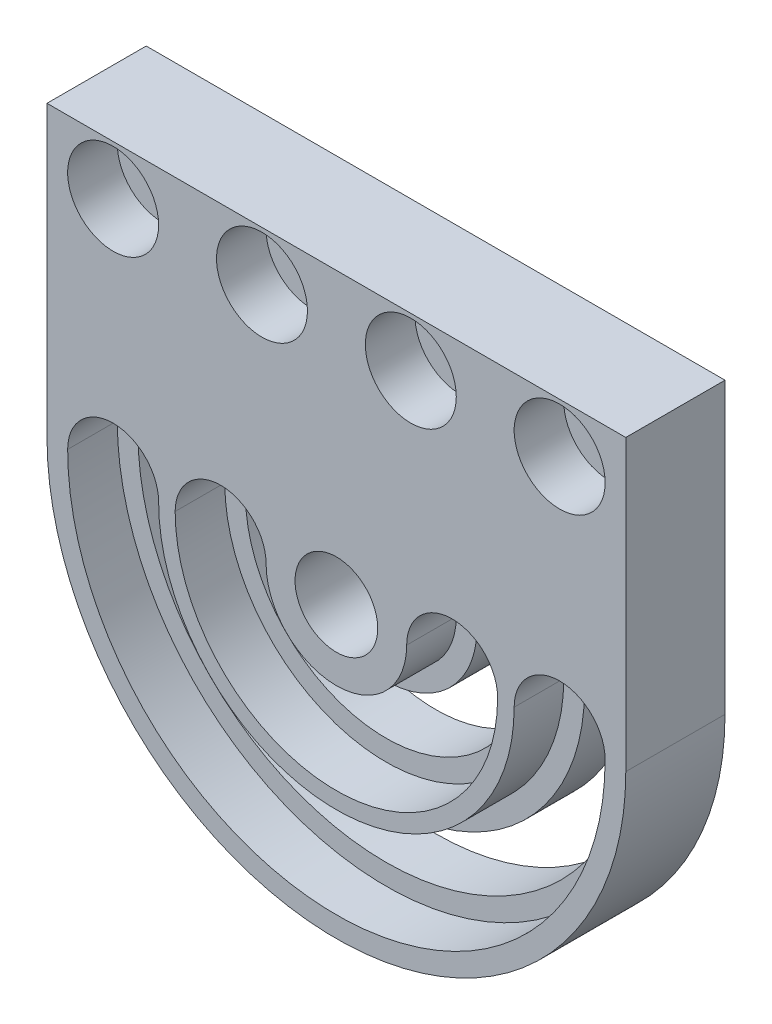
from build123d import *

# Parameters (mm, degrees)
SKETCH_1_R          = 5
SKETCH_1_R_2        = 3
EXTRUDE_1_DEPTH     = 12
SKETCH_2_R          = 5.5
CUT_EXTRUDE_1_DEPTH = 6


with BuildPart() as part:
    # 草图1 → 凸台-拉伸1 (new body)
    with BuildSketch(Plane.XY):
        with BuildLine():
            Line((-35, 0), (-35, 35))
            Line((-35, 35), (35, 35))
            Line((35, 35), (35, 0))
            ThreePointArc((35, 0), (0, -35), (-35, 0))
        make_face()
        Circle(SKETCH_1_R, mode=Mode.SUBTRACT)
        with Locations((-27, 29)):
            Circle(SKETCH_1_R_2, mode=Mode.SUBTRACT)
        with Locations((-9, 29)):
            Circle(SKETCH_1_R_2, mode=Mode.SUBTRACT)
        with Locations((9, 29)):
            Circle(SKETCH_1_R_2, mode=Mode.SUBTRACT)
        with Locations((27, 29)):
            Circle(SKETCH_1_R_2, mode=Mode.SUBTRACT)
        with BuildLine():
            ThreePointArc((30, 0), (27, 3), (24, 0))
            ThreePointArc((24, 0), (0, -24), (-24, 0))
            ThreePointArc((-24, 0), (-27, 3), (-30, 0))
            ThreePointArc((-30, 0), (0, -30), (30, 0))
        make_face(mode=Mode.SUBTRACT)
        with BuildLine():
            ThreePointArc((17, 0), (14, 3), (11, 0))
            ThreePointArc((11, 0), (0, -11), (-11, 0))
            ThreePointArc((-11, 0), (-14, 3), (-17, 0))
            ThreePointArc((-17, 0), (0, -17), (17, 0))
        make_face(mode=Mode.SUBTRACT)
    extrude(amount=EXTRUDE_1_DEPTH)

    # 草图2 → 切除-拉伸1 (cut)
    with BuildSketch(Plane.XY.offset(12)):
        with Locations((-27, 29)):
            Circle(SKETCH_2_R)
        with Locations((-9, 29)):
            Circle(SKETCH_2_R)
        with Locations((9, 29)):
            Circle(SKETCH_2_R)
        with Locations((27, 29)):
            Circle(SKETCH_2_R)
        with BuildLine():
            ThreePointArc((32.5, 0), (27, 5.5), (21.5, 0))
            ThreePointArc((21.5, 0), (0, -21.5), (-21.5, 0))
            ThreePointArc((-21.5, 0), (-27, 5.5), (-32.5, 0))
            ThreePointArc((-32.5, 0), (0, -32.5), (32.5, 0))
        make_face()
        with BuildLine():
            ThreePointArc((19.5, 0), (14, 5.5), (8.5, 0))
            ThreePointArc((8.5, 0), (0, -8.5), (-8.5, 0))
            ThreePointArc((-8.5, 0), (-14, 5.5), (-19.5, 0))
            ThreePointArc((-19.5, 0), (0, -19.5), (19.5, 0))
        make_face()
    extrude(amount=-CUT_EXTRUDE_1_DEPTH, mode=Mode.SUBTRACT)


solid = part.part
